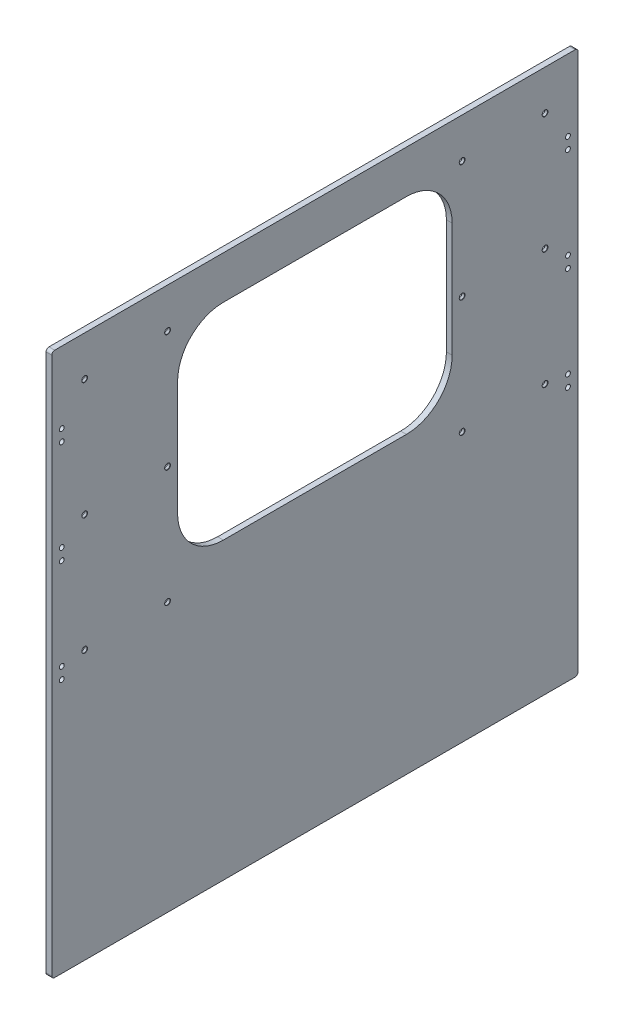
from build123d import *

# Parameters (mm, degrees)
BOSS_EXTRUDE1_DEPTH                           = 12.7
CSK_FOR_1_4_FLAT_HEAD_MACHINE_SCREW1_AT_COUNT = 2
CSK_FOR_1_4_FLAT_HEAD_MACHINE_SCREW1_AT_PITCH = 260.35
CSK_FOR_1_4_FLAT_HEAD_MACHINE_SCREW1_2_COUNT  = 2
CSK_FOR_1_4_FLAT_HEAD_MACHINE_SCREW1_2_PITCH  = 520.7
CSK_FOR_1_4_FLAT_HEAD_MACHINE_SCREW1_3_COUNT  = 2
CSK_FOR_1_4_FLAT_HEAD_MACHINE_SCREW1_3_PITCH  = 184.15
CSK_FOR_1_4_FLAT_HEAD_MACHINE_SCREW1_4_COUNT  = 2
CSK_FOR_1_4_FLAT_HEAD_MACHINE_SCREW1_4_PITCH  = 318.893940049
CSK_FOR_1_4_FLAT_HEAD_MACHINE_SCREW1_5_COUNT  = 2
CSK_FOR_1_4_FLAT_HEAD_MACHINE_SCREW1_5_PITCH  = 552.304003697
CSK_FOR_1_4_FLAT_HEAD_MACHINE_SCREW1_6_COUNT  = 2
CSK_FOR_1_4_FLAT_HEAD_MACHINE_SCREW1_6_PITCH  = 838.2
CSK_FOR_1_4_FLAT_HEAD_MACHINE_SCREW1_7_COUNT  = 2
CSK_FOR_1_4_FLAT_HEAD_MACHINE_SCREW1_7_PITCH  = 877.702319981
CSK_FOR_1_4_FLAT_HEAD_MACHINE_SCREW1_8_COUNT  = 2
CSK_FOR_1_4_FLAT_HEAD_MACHINE_SCREW1_8_PITCH  = 986.766299587
CSK_FOR_1_4_FLAT_HEAD_MACHINE_SCREW1_9_COUNT  = 2
CSK_FOR_1_4_FLAT_HEAD_MACHINE_SCREW1_9_PITCH  = 1022.35
CSK_FOR_1_4_FLAT_HEAD_MACHINE_SCREW1_10_COUNT = 2
CSK_FOR_1_4_FLAT_HEAD_MACHINE_SCREW1_10_PITCH = 1054.979452407
CSK_FOR_1_4_FLAT_HEAD_MACHINE_SCREW1_11_COUNT = 2
CSK_FOR_1_4_FLAT_HEAD_MACHINE_SCREW1_11_PITCH = 1147.313388966
F_27_64_0_42188_DIAMETER_HOLE1_D              = 10.715752


with BuildPart() as part:
    # Sketch1 → Boss-Extrude1 (new body)
    with BuildSketch(Plane(origin=(0, 0, 0), x_dir=(0, 0, -1), z_dir=(1, 0, 0))):
        with BuildLine():
            Line((6.35, 0), (1162.05, 0))
            ThreePointArc((1162.05, 0), (1166.540128061, 1.859871939), (1168.4, 6.35))
            Line((1168.4, 6.35), (1168.4, 1200.15))
            ThreePointArc((1168.4, 1200.15), (1166.540128061, 1204.640128061), (1162.05, 1206.5))
            Line((1162.05, 1206.5), (6.35, 1206.5))
            ThreePointArc((6.35, 1206.5), (1.859871939, 1204.640128061), (0, 1200.15))
            Line((0, 1200.15), (0, 6.35))
            ThreePointArc((0, 6.35), (1.859871939, 1.859871939), (6.35, 0))
        make_face()
        with BuildLine():
            Line((381, 1111.25), (787.4, 1111.25))
            ThreePointArc((787.4, 1111.25), (859.242048969, 1081.492048969), (889, 1009.65))
            Line((889, 1009.65), (889, 755.65))
            ThreePointArc((889, 755.65), (859.242048969, 683.807951031), (787.4, 654.05))
            Line((787.4, 654.05), (381, 654.05))
            ThreePointArc((381, 654.05), (309.157951031, 683.807951031), (279.4, 755.65))
            Line((279.4, 755.65), (279.4, 1009.65))
            ThreePointArc((279.4, 1009.65), (309.157951031, 1081.492048969), (381, 1111.25))
        make_face(mode=Mode.SUBTRACT)
    extrude(amount=BOSS_EXTRUDE1_DEPTH)

    # Sketch3 → CSK for 1/4 Flat Head Machine Screw1 (revolve, cut)
    with BuildSketch(Plane(origin=(12.7, 1117.6, -73.025), x_dir=(0, 0, -1), z_dir=(0, 1, 0))):
        Polygon((0, 0), (0, 12.7), (3.3782, 12.7), (3.3782, 4.536932584), (6.4389, 1.016), (6.4389, 0), align=None)
    csk_for_1_4_flat_head_machine_screw1 = revolve(axis=Axis((19.05, 1117.6, -73.025), (-1, 0, 0)), mode=Mode.SUBTRACT)

    # CSK for 1/4 Flat Head Machine Screw1 at: CSK for 1/4 Flat Head Machine Screw1 ×2
    with Locations(*[(0, -i * CSK_FOR_1_4_FLAT_HEAD_MACHINE_SCREW1_AT_PITCH, 0) for i in range(1, CSK_FOR_1_4_FLAT_HEAD_MACHINE_SCREW1_AT_COUNT)]):
        add(csk_for_1_4_flat_head_machine_screw1, mode=Mode.SUBTRACT)

    # CSK for 1_4 Flat Head Machine Screw1 2: CSK for 1/4 Flat Head Machine Screw1 ×2
    with Locations(*[(0, -i * CSK_FOR_1_4_FLAT_HEAD_MACHINE_SCREW1_2_PITCH, 0) for i in range(1, CSK_FOR_1_4_FLAT_HEAD_MACHINE_SCREW1_2_COUNT)]):
        add(csk_for_1_4_flat_head_machine_screw1, mode=Mode.SUBTRACT)

    # CSK for 1_4 Flat Head Machine Screw1 3: CSK for 1/4 Flat Head Machine Screw1 ×2
    with Locations(*[(0, 0, -i * CSK_FOR_1_4_FLAT_HEAD_MACHINE_SCREW1_3_PITCH) for i in range(1, CSK_FOR_1_4_FLAT_HEAD_MACHINE_SCREW1_3_COUNT)]):
        add(csk_for_1_4_flat_head_machine_screw1, mode=Mode.SUBTRACT)

    # CSK for 1_4 Flat Head Machine Screw1 4: CSK for 1/4 Flat Head Machine Screw1 ×2
    with Locations(*[Vector(0, -0.8164156395068651, -0.5774647206268073) * (i * CSK_FOR_1_4_FLAT_HEAD_MACHINE_SCREW1_4_PITCH) for i in range(1, CSK_FOR_1_4_FLAT_HEAD_MACHINE_SCREW1_4_COUNT)]):
        add(csk_for_1_4_flat_head_machine_screw1, mode=Mode.SUBTRACT)

    # CSK for 1_4 Flat Head Machine Screw1 5: CSK for 1/4 Flat Head Machine Screw1 ×2
    with Locations(*[Vector(0, -0.9427778841259971, -0.3334214468250479) * (i * CSK_FOR_1_4_FLAT_HEAD_MACHINE_SCREW1_5_PITCH) for i in range(1, CSK_FOR_1_4_FLAT_HEAD_MACHINE_SCREW1_5_COUNT)]):
        add(csk_for_1_4_flat_head_machine_screw1, mode=Mode.SUBTRACT)

    # CSK for 1_4 Flat Head Machine Screw1 6: CSK for 1/4 Flat Head Machine Screw1 ×2
    with Locations(*[(0, 0, -i * CSK_FOR_1_4_FLAT_HEAD_MACHINE_SCREW1_6_PITCH) for i in range(1, CSK_FOR_1_4_FLAT_HEAD_MACHINE_SCREW1_6_COUNT)]):
        add(csk_for_1_4_flat_head_machine_screw1, mode=Mode.SUBTRACT)

    # CSK for 1_4 Flat Head Machine Screw1 7: CSK for 1/4 Flat Head Machine Screw1 ×2
    with Locations(*[Vector(0, -0.2966267652176661, -0.9549934880178522) * (i * CSK_FOR_1_4_FLAT_HEAD_MACHINE_SCREW1_7_PITCH) for i in range(1, CSK_FOR_1_4_FLAT_HEAD_MACHINE_SCREW1_7_COUNT)]):
        add(csk_for_1_4_flat_head_machine_screw1, mode=Mode.SUBTRACT)

    # CSK for 1_4 Flat Head Machine Screw1 8: CSK for 1/4 Flat Head Machine Screw1 ×2
    with Locations(*[Vector(0, -0.5276832014004726, -0.8494412510349073) * (i * CSK_FOR_1_4_FLAT_HEAD_MACHINE_SCREW1_8_PITCH) for i in range(1, CSK_FOR_1_4_FLAT_HEAD_MACHINE_SCREW1_8_COUNT)]):
        add(csk_for_1_4_flat_head_machine_screw1, mode=Mode.SUBTRACT)

    # CSK for 1_4 Flat Head Machine Screw1 9: CSK for 1/4 Flat Head Machine Screw1 ×2
    with Locations(*[(0, 0, -i * CSK_FOR_1_4_FLAT_HEAD_MACHINE_SCREW1_9_PITCH) for i in range(1, CSK_FOR_1_4_FLAT_HEAD_MACHINE_SCREW1_9_COUNT)]):
        add(csk_for_1_4_flat_head_machine_screw1, mode=Mode.SUBTRACT)

    # CSK for 1_4 Flat Head Machine Screw1 10: CSK for 1/4 Flat Head Machine Screw1 ×2
    with Locations(*[Vector(0, -0.2467820576089035, -0.9690710067081337) * (i * CSK_FOR_1_4_FLAT_HEAD_MACHINE_SCREW1_10_PITCH) for i in range(1, CSK_FOR_1_4_FLAT_HEAD_MACHINE_SCREW1_10_COUNT)]):
        add(csk_for_1_4_flat_head_machine_screw1, mode=Mode.SUBTRACT)

    # CSK for 1_4 Flat Head Machine Screw1 11: CSK for 1/4 Flat Head Machine Screw1 ×2
    with Locations(*[Vector(0, -0.4538428689212819, -0.891081730443005) * (i * CSK_FOR_1_4_FLAT_HEAD_MACHINE_SCREW1_11_PITCH) for i in range(1, CSK_FOR_1_4_FLAT_HEAD_MACHINE_SCREW1_11_COUNT)]):
        add(csk_for_1_4_flat_head_machine_screw1, mode=Mode.SUBTRACT)

    # 27/64 (0.42188) Diameter Hole1 (through all)
    with Locations(Plane(origin=(12.7, 0, 0), x_dir=(0, 0, -1), z_dir=(1, 0, 0))):
        with Locations((22.225, 1047.75), (22.225, 1022.35), (22.225, 819.15), (22.225, 793.75), (22.225, 590.55), (22.225, 565.15), (1146.175, 1047.75), (1146.175, 1022.35), (1146.175, 819.15), (1146.175, 793.75), (1146.175, 565.15), (1146.175, 590.55)):
            Hole(F_27_64_0_42188_DIAMETER_HOLE1_D / 2)


solid = part.part
